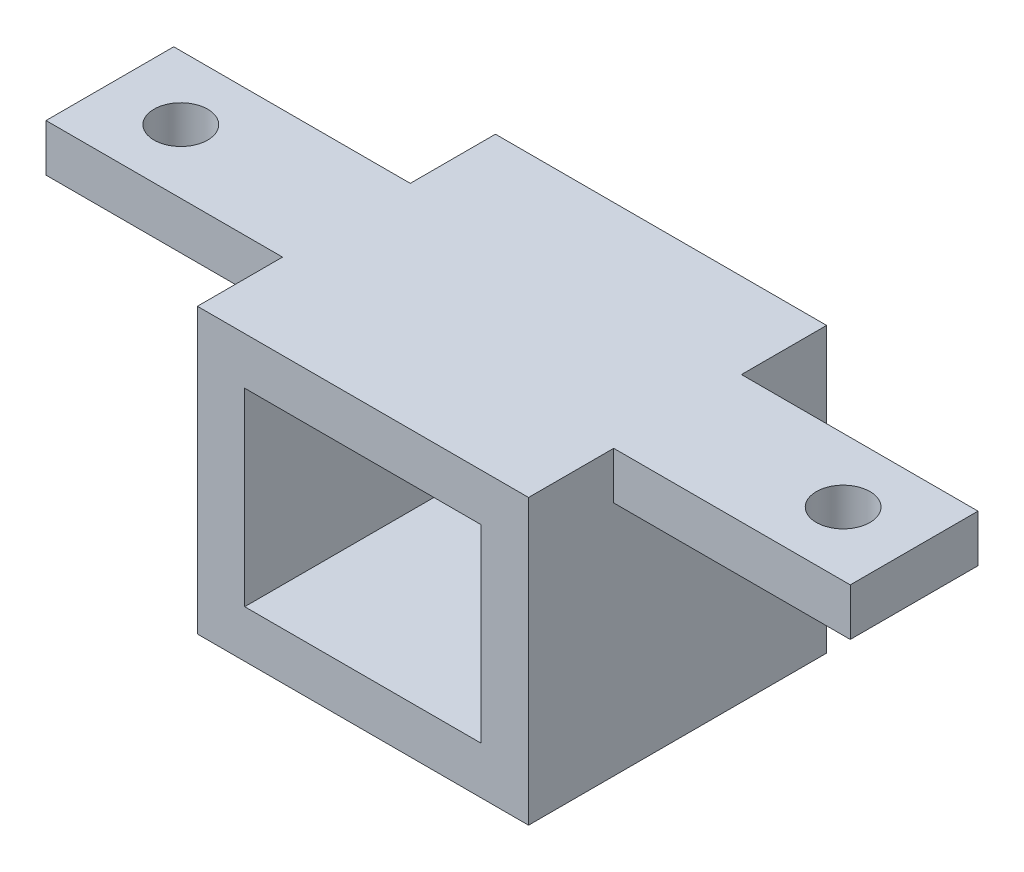
from build123d import *

# Parameters (mm, degrees)
SKETCH1_W           = 17.78
SKETCH1_H           = 16.002
SKETCH1_W_2         = 12.7
SKETCH1_H_2         = 6.858
BOSS_EXTRUDE1_DEPTH = 2.54
SKETCH2_R           = 1.44
CUT_EXTRUDE1_DEPTH  = 24.164535415
SKETCH3_W           = 12.7
SKETCH3_H           = 2.54
BOSS_EXTRUDE2_DEPTH = 10.16
SKETCH4_W           = 17.78
SKETCH4_H           = 16.002
BOSS_EXTRUDE3_DEPTH = 2.54
SKETCH5_R           = 2
SKETCH5_R_2         = 0.8
CUT_EXTRUDE2_DEPTH  = 30.723426855


with BuildPart() as part:
    # Sketch1 → Boss-Extrude1 (new body)
    with BuildSketch(Plane(origin=(0, 0, 0), x_dir=(1, 0, 0), z_dir=(0, 1, 0))):
        Rectangle(SKETCH1_W, SKETCH1_H)
        with Locations((-15.24, 0)):
            Rectangle(SKETCH1_W_2, SKETCH1_H_2)
        with Locations((15.24, 0)):
            Rectangle(SKETCH1_W_2, SKETCH1_H_2)
    extrude(amount=BOSS_EXTRUDE1_DEPTH)

    # Sketch2 → Cut-Extrude1 (cut, through all)
    with BuildSketch(Plane.XZ):
        with Locations(Location((-17.78, 0, 0), (0, 0, 270))):
            Circle(SKETCH2_R)
        with Locations(Location((17.78, 0, 0), (0, 0, 270))):
            Circle(SKETCH2_R)
    extrude(amount=-CUT_EXTRUDE1_DEPTH, mode=Mode.SUBTRACT)

    # Sketch3 → Boss-Extrude2 (add)
    with BuildSketch(Plane(origin=(0, 0, 0), x_dir=(-1, 0, 0), z_dir=(0, -1, 0))):
        Polygon((6.35, -8.001), (8.89, -8.001), (8.89, -3.429), (8.89, 3.429), (8.89, 8.001), (6.35, 8.001), (6.35, 5.461), align=None)
        with Locations((0, 6.731)):
            Rectangle(SKETCH3_W, SKETCH3_H)
        Polygon((-8.89, -8.001), (-6.35, -8.001), (-6.35, 5.461), (-6.35, 8.001), (-8.89, 8.001), (-8.89, 3.429), (-8.89, -3.429), align=None)
    extrude(amount=BOSS_EXTRUDE2_DEPTH)

    # Sketch4 → Boss-Extrude3 (add)
    with BuildSketch(Plane(origin=(0, -10.16, 0), x_dir=(-1, 0, 0), z_dir=(0, -1, 0))):
        Rectangle(SKETCH4_W, SKETCH4_H)
    extrude(amount=BOSS_EXTRUDE3_DEPTH)

    # Sketch5 → Cut-Extrude2 (cut, through all)
    with BuildSketch(Plane(origin=(0, 0, -8.001), x_dir=(-1, 0, 0), z_dir=(0, 0, -1))):
        with Locations((0, -5.08)):
            Circle(SKETCH5_R)
        with Locations((4.699, -5.08)):
            Circle(SKETCH5_R_2)
        with Locations((-4.699, -5.08)):
            Circle(SKETCH5_R_2)
    extrude(amount=-CUT_EXTRUDE2_DEPTH, mode=Mode.SUBTRACT)


solid = part.part
